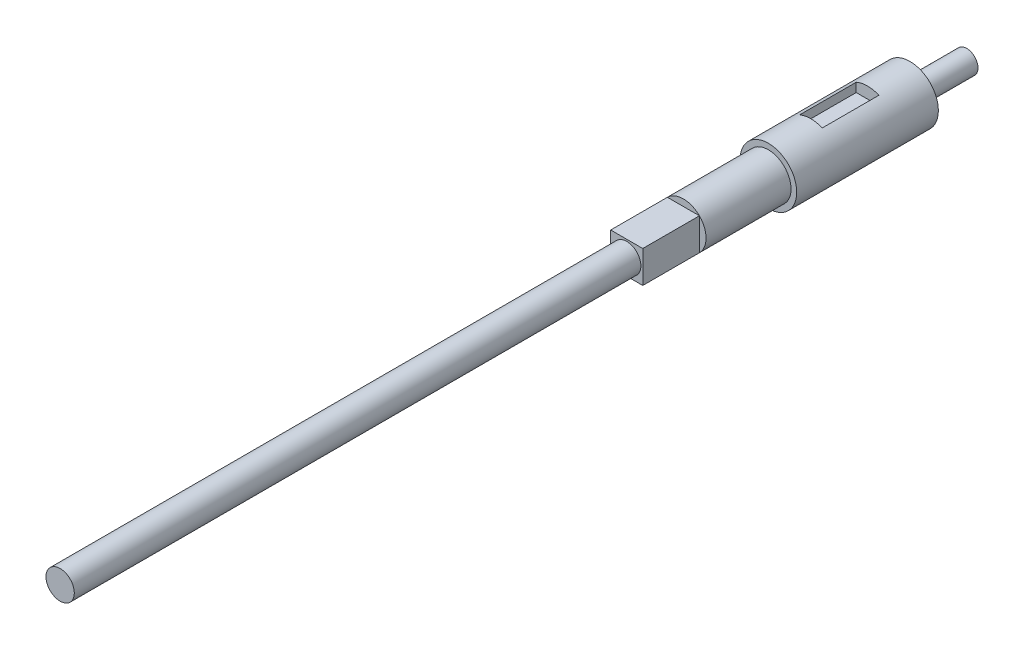
from build123d import *

# Parameters (mm, degrees)
CROQUIS1_R              = 5
SALIENTE_EXTRUIR1_DEPTH = 12.5
CROQUIS2_R              = 2
SALIENTE_EXTRUIR2_DEPTH = 10
CROQUIS3_R              = 4
SALIENTE_EXTRUIR3_DEPTH = 15
CROQUIS4_W              = 5.65685425
CROQUIS4_H              = 5.65685425
SALIENTE_EXTRUIR4_DEPTH = 10
CROQUIS5_W              = 4
CROQUIS5_H              = 10
CORTAR_EXTRUIR1_DEPTH   = 2
CROQUIS6_R              = 2.5
SALIENTE_EXTRUIR5_DEPTH = 100


with BuildPart() as part:
    # Croquis1 → Saliente-Extruir1 (new, symmetric)
    with BuildSketch(Plane.XY):
        Circle(CROQUIS1_R)
    extrude(amount=SALIENTE_EXTRUIR1_DEPTH, both=True)

    # Croquis2 → Saliente-Extruir2 (add)
    with BuildSketch(Plane(origin=(0, 0, -12.5), x_dir=(-1, 0, 0), z_dir=(0, 0, -1))):
        Circle(CROQUIS2_R)
    extrude(amount=SALIENTE_EXTRUIR2_DEPTH)

    # Croquis3 → Saliente-Extruir3 (add)
    with BuildSketch(Plane.XY.offset(12.5)):
        Circle(CROQUIS3_R)
    extrude(amount=SALIENTE_EXTRUIR3_DEPTH)

    # Croquis4 → Saliente-Extruir4 (add)
    with BuildSketch(Plane.XY.offset(27.5)):
        Rectangle(CROQUIS4_W, CROQUIS4_H)
    extrude(amount=SALIENTE_EXTRUIR4_DEPTH)

    # Croquis5 → Cortar-Extruir1 (cut)
    with BuildSketch(Plane(origin=(0, 5, 0), x_dir=(1, 0, 0), z_dir=(0, 1, 0))):
        Rectangle(CROQUIS5_W, CROQUIS5_H)
    extrude(amount=-CORTAR_EXTRUIR1_DEPTH, mode=Mode.SUBTRACT)

    # Croquis6 → Saliente-Extruir5 (add)
    with BuildSketch(Plane.XY.offset(37.5)):
        Circle(CROQUIS6_R)
    extrude(amount=SALIENTE_EXTRUIR5_DEPTH)


solid = part.part
